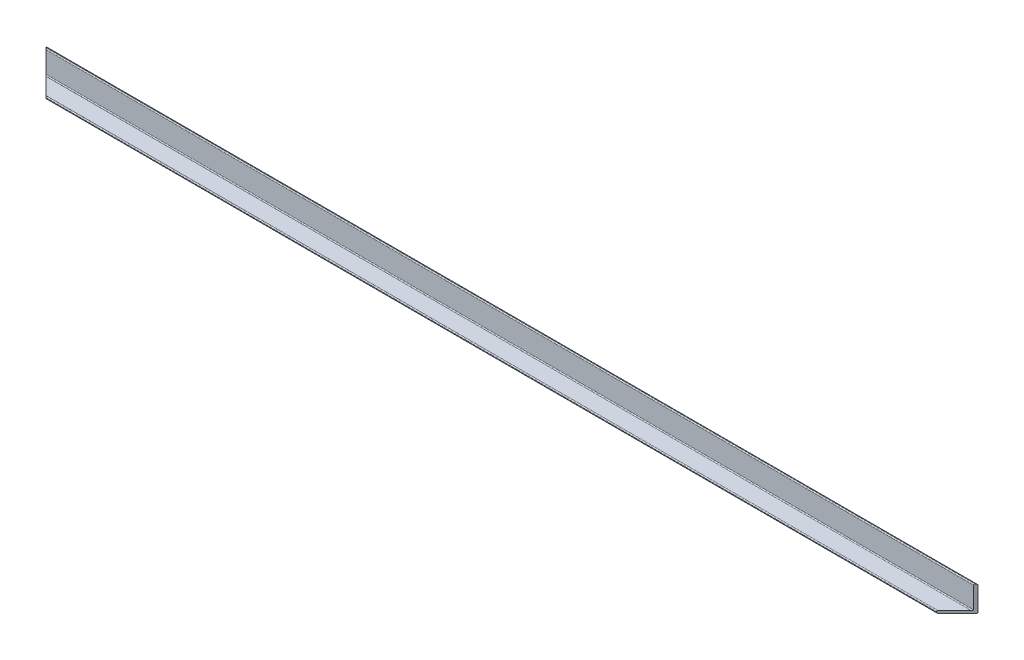
from build123d import *

# Parameters (mm, degrees)
SKETCH1_W           = 1010
SKETCH1_H           = 22.5
BOSS_EXTRUDE1_DEPTH = 2.5
SKETCH2_W           = 1010
SKETCH2_H           = 2.5
BOSS_EXTRUDE2_DEPTH = 25
CUT_EXTRUDE1_DEPTH  = 506.873316652
FILLET1_R           = 1


with BuildPart() as part:
    # Sketch1 → Boss-Extrude1 (new body)
    with BuildSketch(Plane(origin=(0, 0, 0), x_dir=(1, 0, 0), z_dir=(0, 1, 0))):
        Rectangle(SKETCH1_W, SKETCH1_H)
    extrude(amount=BOSS_EXTRUDE1_DEPTH)

    # Sketch2 → Boss-Extrude2 (add)
    with BuildSketch(Plane(origin=(0, 2.5, 0), x_dir=(1, 0, 0), z_dir=(0, 1, 0))):
        with Locations((0, 10)):
            Rectangle(SKETCH2_W, SKETCH2_H)
    extrude(amount=BOSS_EXTRUDE2_DEPTH)

    # Sketch3 → Cut-Extrude1 (cut, through all)
    with BuildSketch(Plane(origin=(0, 0, 0), x_dir=(-1, 0, 0), z_dir=(0, -1, 0))):
        Polygon((505, 11.25), (505, -11.25), (482.5, -11.25), align=None)
        Polygon((-505, 11.25), (-505, -11.25), (-482.5, -11.25), align=None)
    extrude(amount=-CUT_EXTRUDE1_DEPTH, mode=Mode.SUBTRACT)

    # Fillet1
    fillet1_edges = [part.edges().sort_by_distance(p)[0] for p in [
        (0, 27.5, -11.25),
        (0, 27.5, -8.75),
        (0, 2.5, -8.75),
        (0, 0, 11.25),
        (0, 2.5, 11.25),
        (0, 0, -11.25),
    ]]
    fillet(fillet1_edges, radius=FILLET1_R)


solid = part.part
